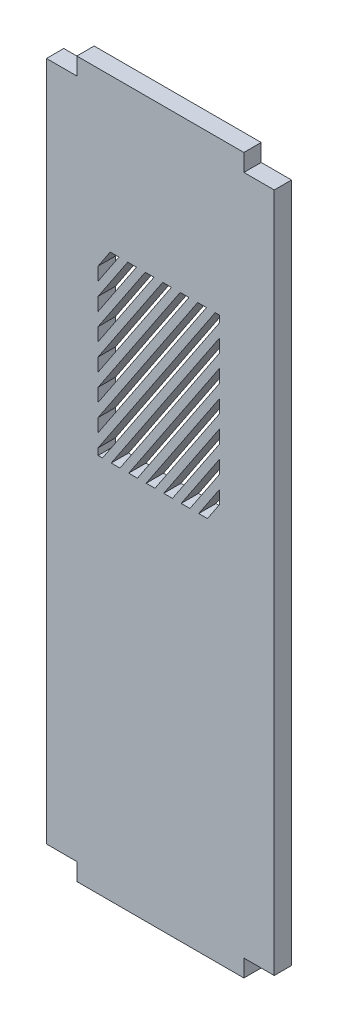
from build123d import *

# Parameters (mm, degrees)
SKETCH1_W           = 75
SKETCH1_H           = 235.4
BOSS_EXTRUDE1_DEPTH = 5.7
SKETCH2_W           = 10
SKETCH2_H           = 5.7
CUT_EXTRUDE1_DEPTH  = 5.7
CUT_EXTRUDE2_DEPTH  = 5.7
CUT_EXTRUDE3_START  = -3.7
SKETCH4_R           = 1.5
CUT_EXTRUDE3_DEPTH  = 2


with BuildPart() as part:
    # Sketch1 → Boss-Extrude1 (new body)
    with BuildSketch(Plane.XY):
        with Locations((37.5, 117.7)):
            Rectangle(SKETCH1_W, SKETCH1_H)
    extrude(amount=BOSS_EXTRUDE1_DEPTH)

    # Sketch2 → Cut-Extrude1 (cut)
    with BuildSketch(Plane(origin=(0, 0, 0), x_dir=(-1, 0, 0), z_dir=(0, 0, -1))):
        with Locations((-70, 2.85)):
            Rectangle(SKETCH2_W, SKETCH2_H)
        with Locations((-5, 2.85)):
            Rectangle(SKETCH2_W, SKETCH2_H)
        with Locations((-5, 232.55)):
            Rectangle(SKETCH2_W, SKETCH2_H)
        with Locations((-70, 232.55)):
            Rectangle(SKETCH2_W, SKETCH2_H)
    extrude(amount=-CUT_EXTRUDE1_DEPTH, mode=Mode.SUBTRACT)

    # Sketch3 → Cut-Extrude2 (cut)
    with BuildSketch(Plane.XY.offset(5.7)):
        Polygon((57, 185), (55.55777949, 185), (17, 127.163330765), (17, 125), (18.44222051, 125), (57, 182.836669235), align=None)
        Polygon((52.67777949, 185), (49.79777949, 185), (17, 135.803330765), (17, 131.483330765), align=None)
        Polygon((46.91777949, 185), (44.03777949, 185), (17, 144.443330765), (17, 140.123330765), align=None)
        Polygon((41.15777949, 185), (38.27777949, 185), (17, 153.083330765), (17, 148.763330765), align=None)
        Polygon((35.39777949, 185), (32.51777949, 185), (17, 161.723330765), (17, 157.403330765), align=None)
        Polygon((29.63777949, 185), (26.75777949, 185), (17, 170.363330765), (17, 166.043330765), align=None)
        Polygon((23.87777949, 185), (20.99777949, 185), (17, 179.003330765), (17, 174.683330765), align=None)
        Polygon((57, 174.196669235), (57, 178.516669235), (21.32222051, 125), (24.20222051, 125), align=None)
        Polygon((57, 165.556669235), (57, 169.876669235), (27.08222051, 125), (29.96222051, 125), align=None)
        Polygon((57, 156.916669235), (57, 161.236669235), (32.84222051, 125), (35.72222051, 125), align=None)
        Polygon((57, 148.276669235), (57, 152.596669235), (38.60222051, 125), (41.48222051, 125), align=None)
        Polygon((57, 139.636669235), (57, 143.956669235), (44.36222051, 125), (47.24222051, 125), align=None)
        Polygon((57, 130.996669235), (57, 135.316669235), (50.12222051, 125), (53.00222051, 125), align=None)
    extrude(amount=-CUT_EXTRUDE2_DEPTH, mode=Mode.SUBTRACT)

    # Sketch4 → Cut-Extrude3 (cut)
    with BuildSketch(Plane.XY.offset(5.7).offset(CUT_EXTRUDE3_START)):
        with Locations((64.3, 20.7)):
            Circle(SKETCH4_R)
        with Locations((29.3, 20.7)):
            Circle(SKETCH4_R)
        with Locations((64.3, 214.7)):
            Circle(SKETCH4_R)
        with Locations((29.3, 214.7)):
            Circle(SKETCH4_R)
    extrude(amount=-CUT_EXTRUDE3_DEPTH, mode=Mode.SUBTRACT)


solid = part.part
